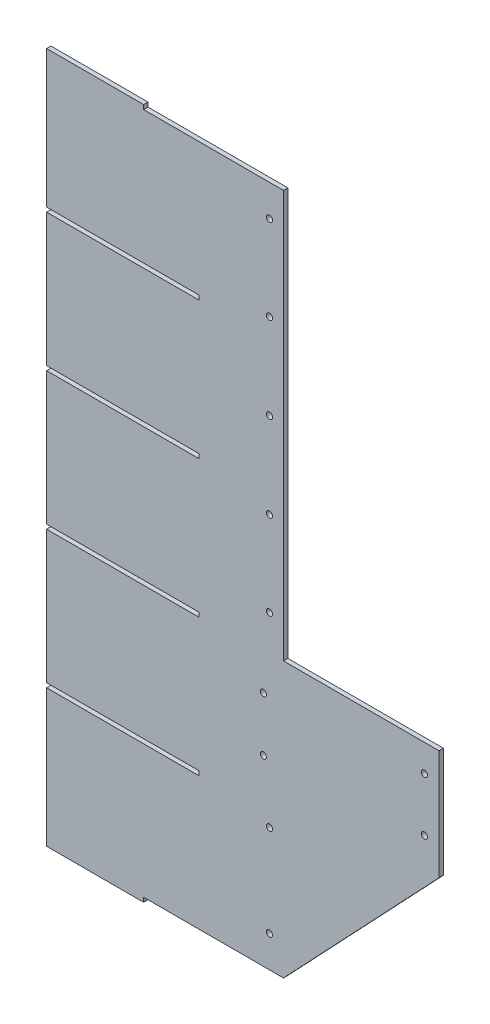
from build123d import *

# Parameters (mm, degrees)
BOSS_EXTRUDE2_DEPTH = 3.175
BOSS_EXTRUDE3_DEPTH = 3.175
BOSS_EXTRUDE6_DEPTH = 3.175
SKETCH8_W           = 70.49262
SKETCH8_H           = 3.175
BOSS_EXTRUDE7_DEPTH = 3.175
SKETCH14_R          = 2.25
CUT_EXTRUDE1_DEPTH  = 371.49176257
SKETCH15_R          = 2.25
CUT_EXTRUDE2_DEPTH  = 371.49176257


with BuildPart() as part:
    # Sketch1 → Boss-Extrude2 (new body)
    with BuildSketch(Plane.XY):
        Polygon((129.013076168, 254.245404572), (-18.685383832, 254.245404572), (-18.685383832, 157.666984572), (92.088461168, 157.666984572), (92.088461168, 154.491984572), (-18.685383832, 154.491984572), (-18.685383832, 57.913564572), (92.088461168, 57.913564572), (92.088461168, 54.738564572), (-18.685383832, 54.738564572), (-18.685383832, -41.839855428), (92.088461168, -41.839855428), (92.088461168, -45.014855428), (-18.685383832, -45.014855428), (-18.685383832, -141.593275428), (92.088461168, -141.593275428), (92.088461168, -144.768275428), (-18.685383832, -144.768275428), (-18.685383832, -241.346695428), (129.013076168, -241.346695428), align=None)
    extrude(amount=BOSS_EXTRUDE2_DEPTH)

    # Sketch2 → Boss-Extrude3 (add, through all)
    with BuildSketch(Plane.XY.offset(3.175)):
        Polygon((129.013076168, 254.245404572), (129.013076168, -241.346695428), (153.407236168, -241.346695428), (153.407236168, -227.262720585), (153.407236168, -187.892720585), (153.407236168, -143.180775428), (153.407236168, 240.16142973), (153.407236168, 254.245404572), align=None)
    extrude(amount=-BOSS_EXTRUDE3_DEPTH)

    # Sketch7 → Boss-Extrude6 (add, through all)
    with BuildSketch(Plane.XY.offset(3.175)):
        Polygon((153.22938521, -121.781069434), (153.407236168, -41.839855428), (266.437236168, -41.839855428), (266.437236168, -121.781069434), (153.407236168, -241.346695428), align=None)
    extrude(amount=-BOSS_EXTRUDE6_DEPTH)

    # Sketch8 → Boss-Extrude7 (add, through all)
    with BuildSketch(Plane.XY.offset(3.175)):
        with Locations((16.560926168, 255.832904572)):
            Rectangle(SKETCH8_W, SKETCH8_H)
        with Locations((16.560926168, -242.934195428)):
            Rectangle(SKETCH8_W, SKETCH8_H)
    extrude(amount=-BOSS_EXTRUDE7_DEPTH)

    # Sketch14 → Cut-Extrude1 (cut, through all)
    with BuildSketch(Plane(origin=(0, 0, 0), x_dir=(-1, 0, 0), z_dir=(0, 0, -1))):
        with Locations((-143.247236168, -218.414588646)):
            Circle(SKETCH14_R)
        with Locations((-143.247236168, -151.753275428)):
            Circle(SKETCH14_R)
        with Locations((-255.799716168, -100.445275428)):
            Circle(SKETCH14_R)
        with Locations((-255.799716168, -61.596962209)):
            Circle(SKETCH14_R)
        with Locations((-143.247236168, -16.439855428)):
            Circle(SKETCH14_R)
        with Locations((-143.247236168, 45.232941839)):
            Circle(SKETCH14_R)
        with Locations((-143.247236168, 107.436721182)):
            Circle(SKETCH14_R)
        with Locations((-143.247236168, 169.640500525)):
            Circle(SKETCH14_R)
        with Locations((-143.247236168, 231.313297791)):
            Circle(SKETCH14_R)
    extrude(amount=-CUT_EXTRUDE1_DEPTH, mode=Mode.SUBTRACT)

    # Sketch15 → Cut-Extrude2 (cut, through all)
    with BuildSketch(Plane(origin=(0, 0, 0), x_dir=(-1, 0, 0), z_dir=(0, 0, -1))):
        with Locations((-138.792076168, -108.552320428)):
            Circle(SKETCH15_R)
        with Locations((-138.792076168, -69.242010428)):
            Circle(SKETCH15_R)
    extrude(amount=-CUT_EXTRUDE2_DEPTH, mode=Mode.SUBTRACT)


solid = part.part
